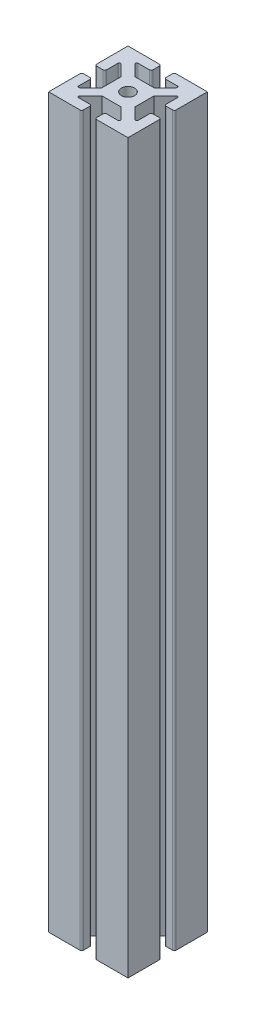
from build123d import *

# Parameters (mm, degrees)
SKETCH1_R           = 1
BOSS_EXTRUDE1_DEPTH = 110


with BuildPart() as part:
    # Sketch1 → Boss-Extrude1 (new body)
    with BuildSketch(Plane(origin=(0, 0, 0), x_dir=(1, 0, 0), z_dir=(0, 1, 0))):
        with BuildLine():
            Line((1.25, 6), (6, 6))
            Line((6, 6), (6, 1.25))
            ThreePointArc((6, 1.25), (5.926776695, 1.073223305), (5.75, 1))
            Line((5.75, 1), (4.75, 1))
            ThreePointArc((4.75, 1), (4.573223305, 1.073223305), (4.5, 1.25))
            Line((4.5, 1.25), (4.5, 2.973453617))
            ThreePointArc((4.5, 2.973453617), (4.380872479, 3.151740551), (4.170568701, 3.109908529))
            Line((4.170568701, 3.109908529), (2.5, 1.439339828))
            Line((2.5, 1.439339828), (2.5, -1.439339828))
            Line((2.5, -1.439339828), (4.170568701, -3.109908529))
            ThreePointArc((4.170568701, -3.109908529), (4.380872479, -3.151740551), (4.5, -2.973453617))
            Line((4.5, -2.973453617), (4.5, -1.25))
            ThreePointArc((4.5, -1.25), (4.573223305, -1.073223305), (4.75, -1))
            Line((4.75, -1), (5.75, -1))
            ThreePointArc((5.75, -1), (5.926776695, -1.073223305), (6, -1.25))
            Line((6, -1.25), (6, -6))
            Line((6, -6), (1.25, -6))
            ThreePointArc((1.25, -6), (1.073223305, -5.926776695), (1, -5.75))
            Line((1, -5.75), (1, -4.75))
            ThreePointArc((1, -4.75), (1.073223305, -4.573223305), (1.25, -4.5))
            Line((1.25, -4.5), (2.973453617, -4.5))
            ThreePointArc((2.973453617, -4.5), (3.151740551, -4.380872479), (3.109908529, -4.170568701))
            Line((3.109908529, -4.170568701), (1.439339828, -2.5))
            Line((1.439339828, -2.5), (-1.439339828, -2.5))
            Line((-1.439339828, -2.5), (-3.109908529, -4.170568701))
            ThreePointArc((-3.109908529, -4.170568701), (-3.151740551, -4.380872479), (-2.973453617, -4.5))
            Line((-2.973453617, -4.5), (-1.25, -4.5))
            ThreePointArc((-1.25, -4.5), (-1.073223305, -4.573223305), (-1, -4.75))
            Line((-1, -4.75), (-1, -5.75))
            ThreePointArc((-1, -5.75), (-1.073223305, -5.926776695), (-1.25, -6))
            Line((-1.25, -6), (-6, -6))
            Line((-6, -6), (-6, -1.25))
            ThreePointArc((-6, -1.25), (-5.926776695, -1.073223305), (-5.75, -1))
            Line((-5.75, -1), (-4.75, -1))
            ThreePointArc((-4.75, -1), (-4.573223305, -1.073223305), (-4.5, -1.25))
            Line((-4.5, -1.25), (-4.5, -2.973453617))
            ThreePointArc((-4.5, -2.973453617), (-4.380872479, -3.151740551), (-4.170568701, -3.109908529))
            Line((-4.170568701, -3.109908529), (-2.5, -1.439339828))
            Line((-2.5, -1.439339828), (-2.5, 1.439339828))
            Line((-2.5, 1.439339828), (-4.170568701, 3.109908529))
            ThreePointArc((-4.170568701, 3.109908529), (-4.380872479, 3.151740551), (-4.5, 2.973453617))
            Line((-4.5, 2.973453617), (-4.5, 1.25))
            ThreePointArc((-4.5, 1.25), (-4.573223305, 1.073223305), (-4.75, 1))
            Line((-4.75, 1), (-5.75, 1))
            ThreePointArc((-5.75, 1), (-5.926776695, 1.073223305), (-6, 1.25))
            Line((-6, 1.25), (-6, 6))
            Line((-6, 6), (-1.25, 6))
            ThreePointArc((-1.25, 6), (-1.073223305, 5.926776695), (-1, 5.75))
            Line((-1, 5.75), (-1, 4.75))
            ThreePointArc((-1, 4.75), (-1.073223305, 4.573223305), (-1.25, 4.5))
            Line((-1.25, 4.5), (-2.973453617, 4.5))
            ThreePointArc((-2.973453617, 4.5), (-3.151740551, 4.380872479), (-3.109908529, 4.170568701))
            Line((-3.109908529, 4.170568701), (-1.439339828, 2.5))
            Line((-1.439339828, 2.5), (1.439339828, 2.5))
            Line((1.439339828, 2.5), (3.109908529, 4.170568701))
            ThreePointArc((3.109908529, 4.170568701), (3.151740551, 4.380872479), (2.973453617, 4.5))
            Line((2.973453617, 4.5), (1.25, 4.5))
            ThreePointArc((1.25, 4.5), (1.073223305, 4.573223305), (1, 4.75))
            Line((1, 4.75), (1, 5.75))
            ThreePointArc((1, 5.75), (1.073223305, 5.926776695), (1.25, 6))
        make_face()
        with Locations(Location((0, 0, 0), (0, 0, 270))):
            Circle(SKETCH1_R, mode=Mode.SUBTRACT)
    extrude(amount=BOSS_EXTRUDE1_DEPTH)


solid = part.part
